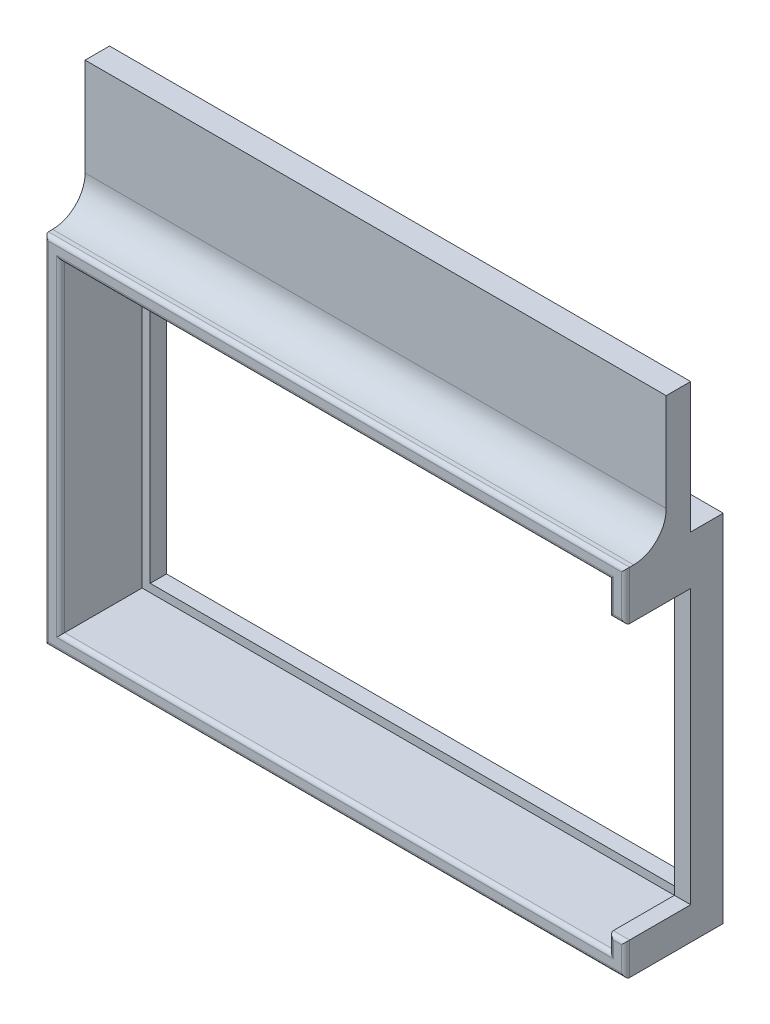
from build123d import *

# Parameters (mm, degrees)
ESQUISSE1_W              = 35.68
ESQUISSE1_H              = 21.82
BOSS_EXTRU_1_DEPTH       = 6
ESQUISSE2_W              = 33.68
ESQUISSE2_H              = 19.82
ENL_V_MAT_EXTRU_1_DEPTH  = 5
ESQUISSE3_W              = 32.68
ESQUISSE3_H              = 18.82
ENL_V_MAT_EXTRU_2_DEPTH  = 43.120954405
ESQUISSE4_W              = 4
ESQUISSE4_H              = 16.82
ENL_V_MAT_EXTRU_3_DEPTH  = 5
ESQUISSE6_W              = 35.68
ESQUISSE6_H              = 8
BOSS_EXTRU_2_DEPTH       = 4
ESQUISSE7_W              = 35.68
ESQUISSE7_H              = 8
ENL_V_MAT_EXTRU_12_DEPTH = 2.5
CONG_2_R                 = 0.25
CONG_3_R                 = 2


with BuildPart() as part:
    # Esquisse1 → Boss.-Extru.1 (new body)
    with BuildSketch(Plane.XY):
        with Locations((17.84, 10.91)):
            Rectangle(ESQUISSE1_W, ESQUISSE1_H)
    extrude(amount=BOSS_EXTRU_1_DEPTH)

    # Esquisse2 → Enlèv. mat.-Extru.1 (cut)
    with BuildSketch(Plane.XY.offset(6)):
        with Locations((17.84, 10.91)):
            Rectangle(ESQUISSE2_W, ESQUISSE2_H)
    extrude(amount=-ENL_V_MAT_EXTRU_1_DEPTH, mode=Mode.SUBTRACT)

    # Esquisse3 → Enlèv. mat.-Extru.2 (cut, through all)
    with BuildSketch(Plane.XY.offset(1)):
        with Locations((17.84, 10.91)):
            Rectangle(ESQUISSE3_W, ESQUISSE3_H)
    extrude(amount=-ENL_V_MAT_EXTRU_2_DEPTH, mode=Mode.SUBTRACT)

    # Esquisse4 → Enlèv. mat.-Extru.3 (cut)
    with BuildSketch(Plane(origin=(35.68, 0, 0), x_dir=(0, 0, -1), z_dir=(1, 0, 0))):
        with Locations((-4, 10.41)):
            Rectangle(ESQUISSE4_W, ESQUISSE4_H)
    extrude(amount=-ENL_V_MAT_EXTRU_3_DEPTH, mode=Mode.SUBTRACT)

    # Esquisse6 → Boss.-Extru.2 (add)
    with BuildSketch(Plane.XY.offset(6)):
        with Locations((17.84, 25.82)):
            Rectangle(ESQUISSE6_W, ESQUISSE6_H)
    extrude(amount=-BOSS_EXTRU_2_DEPTH)

    # Esquisse7 → Enlèv. mat.-Extru.12 (cut)
    with BuildSketch(Plane.XY.offset(6)):
        with Locations((17.84, 25.82)):
            Rectangle(ESQUISSE7_W, ESQUISSE7_H)
    extrude(amount=-ENL_V_MAT_EXTRU_12_DEPTH, mode=Mode.SUBTRACT)

    # Congé2
    cong_2_edges = [part.edges().sort_by_distance(p)[0] for p in [
        (35.68, 1, 6),
        (1, 10.91, 6),
        (17.84, 1, 6),
        (34.68, 1.5, 6),
        (17.84, 20.82, 6),
        (34.68, 19.82, 6),
        (35.68, 20.32, 6),
        (35.18, 2, 6),
        (35.18, 18.82, 6),
        (17.84, 0, 6),
        (0, 10.91, 6),
        (17.84, 21.82, 6),
    ]]
    fillet(cong_2_edges, radius=CONG_2_R)

    # Congé3
    cong_3_edges = [part.edges().sort_by_distance(p)[0] for p in [
        (17.84, 21.82, 3.5),
    ]]
    fillet(cong_3_edges, radius=CONG_3_R)


solid = part.part
